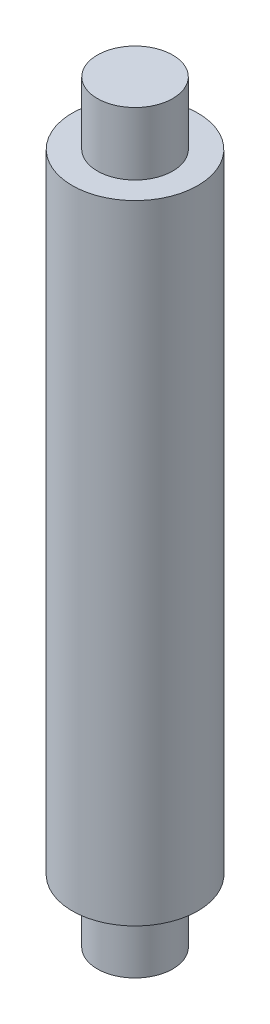
from build123d import *


with BuildPart() as part:
    # Sketch1 → Revolve1 (revolve)
    with BuildSketch(Plane.XY, mode=Mode.PRIVATE) as revolve1_sk:
        Polygon((0, 60), (-6, 60), (-6, 50), (-10, 50), (-10, -50), (-6, -50), (-6, -60), (0, -60), align=None)
    revolve(revolve1_sk.sketch.rotate(Axis((0, -60, 0), (0, 1, 0)), 180), axis=Axis((0, -60, 0), (0, 1, 0)))


solid = part.part
